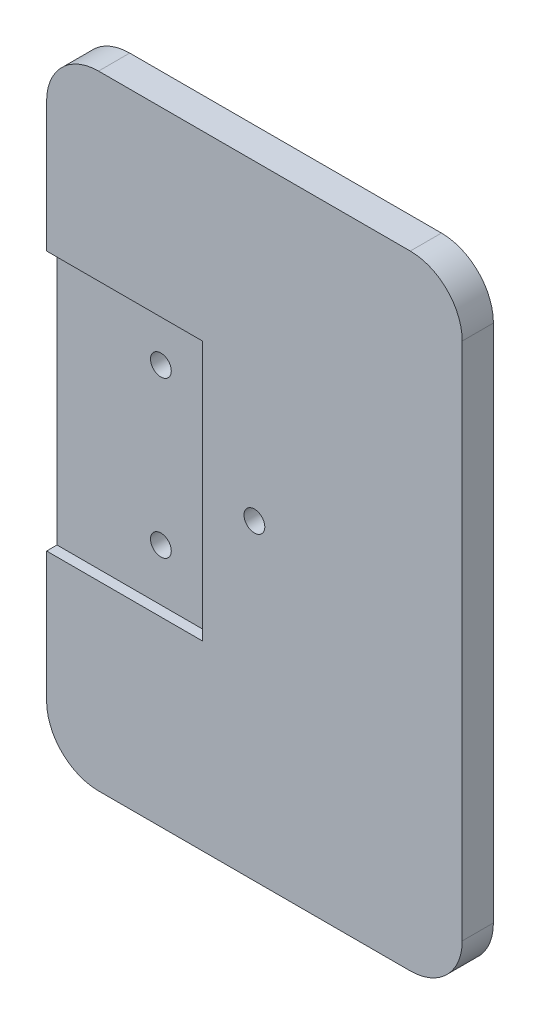
from build123d import *

# Parameters (mm, degrees)
SKETCH1_W           = 40
SKETCH1_H           = 60
BOSS_EXTRUDE4_DEPTH = 3
SKETCH5_W           = 15
SKETCH5_H           = 25
CUT_EXTRUDE2_DEPTH  = 1
SKETCH7_R           = 1
CUT_EXTRUDE3_DEPTH  = 2
SKETCH8_R           = 1
CUT_EXTRUDE4_DEPTH  = 2
FILLET1_R           = 5
SKETCH12_R          = 1
CUT_EXTRUDE6_DEPTH  = 12


with BuildPart() as part:
    # Sketch1 → Boss-Extrude4 (new body)
    with BuildSketch(Plane.XY):
        with Locations((-45.9850693, -3.193565597)):
            Rectangle(SKETCH1_W, SKETCH1_H)
    extrude(amount=-BOSS_EXTRUDE4_DEPTH)

    # Sketch5 → Cut-Extrude2 (cut)
    with BuildSketch(Plane.XY):
        with Locations((-58.4850693, -3.193565597)):
            Rectangle(SKETCH5_W, SKETCH5_H)
    extrude(amount=-CUT_EXTRUDE2_DEPTH, mode=Mode.SUBTRACT)

    # Sketch7 → Cut-Extrude3 (cut)
    with BuildSketch(Plane.XY.offset(-1)):
        with Locations((-55.9850693, 4.306434403)):
            Circle(SKETCH7_R)
    extrude(amount=-CUT_EXTRUDE3_DEPTH, mode=Mode.SUBTRACT)

    # Sketch8 → Cut-Extrude4 (cut)
    with BuildSketch(Plane.XY.offset(-1)):
        with Locations((-55.9850693, -10.693565597)):
            Circle(SKETCH8_R)
    extrude(amount=-CUT_EXTRUDE4_DEPTH, mode=Mode.SUBTRACT)

    # Fillet1
    fillet1_edges = [part.edges().sort_by_distance(p)[0] for p in [
        (-65.9850693, 26.806434403, -1.5),
        (-65.9850693, -33.193565597, -1.5),
        (-25.9850693, -33.193565597, -1.5),
        (-25.9850693, 26.806434403, -1.5),
    ]]
    fillet(fillet1_edges, radius=FILLET1_R)

    # Sketch12 → Cut-Extrude6 (cut)
    with BuildSketch(Plane(origin=(0, 0, -3), x_dir=(-1, 0, 0), z_dir=(0, 0, -1))):
        with Locations((45.9850693, -3.193565597)):
            Circle(SKETCH12_R)
    extrude(amount=-CUT_EXTRUDE6_DEPTH, mode=Mode.SUBTRACT)


solid = part.part
